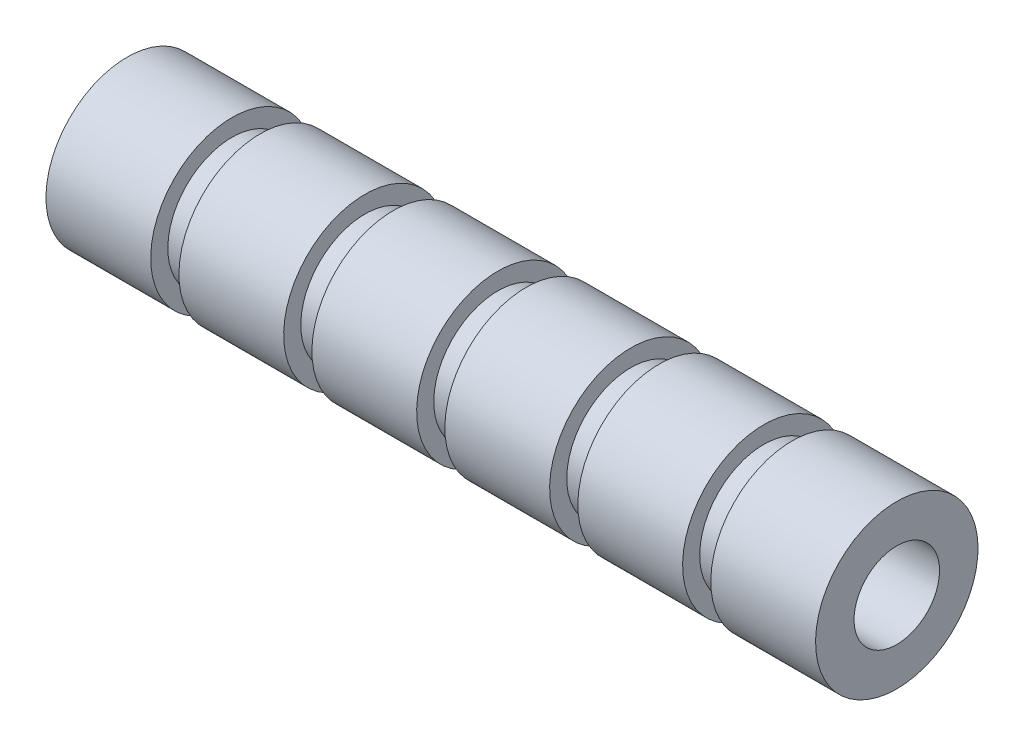
from build123d import *

# Parameters (mm, degrees)
SKETCH2_R          = 5
CUT_EXTRUDE1_DEPTH = 91.997252706


with BuildPart() as part:
    # Sketch1 → Revolve1 (revolve)
    with BuildSketch(Plane.XY, mode=Mode.PRIVATE) as revolve1_sk:
        Polygon((-45, 0), (45, 0), (45, 9.5), (32.75, 9.5), (32.75, 7.5), (29.45, 7.5), (29.45, 9.5), (17.2, 9.5), (17.2, 7.5), (13.9, 7.5), (13.9, 9.5), (1.65, 9.5), (1.65, 7.5), (-1.65, 7.5), (-1.65, 9.5), (-13.9, 9.5), (-13.9, 7.5), (-17.2, 7.5), (-17.2, 9.5), (-29.45, 9.5), (-29.45, 7.5), (-32.75, 7.5), (-32.75, 9.5), (-45, 9.5), align=None)
    revolve(revolve1_sk.sketch.rotate(Axis((-45, 0, 0), (1, 0, 0)), 180), axis=Axis((-45, 0, 0), (1, 0, 0)))

    # Sketch2 → Cut-Extrude1 (cut, through all)
    with BuildSketch(Plane(origin=(45, 0, 0), x_dir=(0, 0, -1), z_dir=(1, 0, 0))):
        with Locations(Location((0, 0, 0), (0, 0, 90))):
            Circle(SKETCH2_R)
    extrude(amount=-CUT_EXTRUDE1_DEPTH, mode=Mode.SUBTRACT)


solid = part.part
